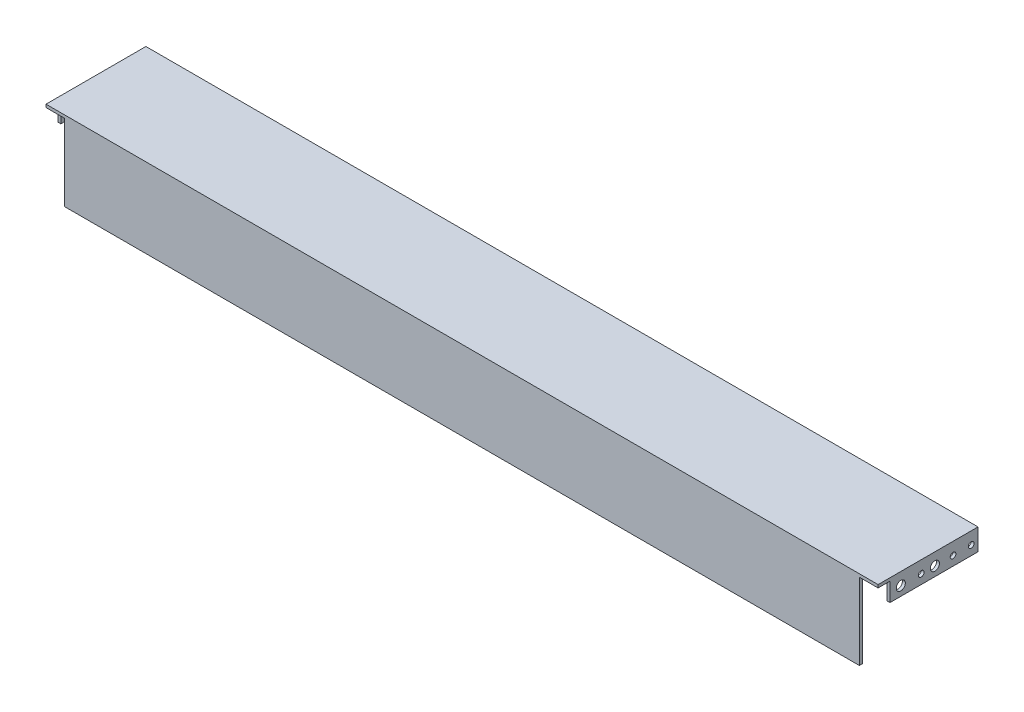
from build123d import *

# Parameters (mm, degrees)
SKETCH1_W           = 700
SKETCH1_H           = 70
BOSS_EXTRUDE1_DEPTH = 2.6
SKETCH2_W           = 733
SKETCH2_H           = 88
BOSS_EXTRUDE2_DEPTH = 2.6
SKETCH3_W           = 77.5
SKETCH3_H           = 16.4
SKETCH3_R           = 2.5
SKETCH3_R_2         = 4
BOSS_EXTRUDE3_DEPTH = 2.6
BOSS_EXTRUDE4_START = -2.6
SKETCH4_W           = 77.5
SKETCH4_H           = 16.4
SKETCH4_R           = 2.5
SKETCH4_R_2         = 4
BOSS_EXTRUDE4_DEPTH = 2.6


with BuildPart() as part:
    # Sketch1 → Boss-Extrude1 (new body)
    with BuildSketch(Plane.XY):
        Rectangle(SKETCH1_W, SKETCH1_H)
    extrude(amount=-BOSS_EXTRUDE1_DEPTH)

    # Sketch2 → Boss-Extrude2 (add)
    with BuildSketch(Plane(origin=(0, 35, 0), x_dir=(1, 0, 0), z_dir=(0, 1, 0))):
        with Locations((0, 44)):
            Rectangle(SKETCH2_W, SKETCH2_H)
    extrude(amount=-BOSS_EXTRUDE2_DEPTH)

    # Sketch3 → Boss-Extrude3 (add)
    with BuildSketch(Plane.ZY.offset(366.5)):
        with Locations((-49.25, 24.2)):
            Rectangle(SKETCH3_W, SKETCH3_H)
        with Locations(Location((-82, 24.2, 0), (0, 0, 270))):
            Circle(SKETCH3_R, mode=Mode.SUBTRACT)
        with Locations(Location((-66, 24.2, 0), (0, 0, 270))):
            Circle(SKETCH3_R, mode=Mode.SUBTRACT)
        with Locations(Location((-50, 24.2, 0), (0, 0, 270))):
            Circle(SKETCH3_R_2, mode=Mode.SUBTRACT)
        with Locations(Location((-38, 24.2, 0), (0, 0, 270))):
            Circle(SKETCH3_R, mode=Mode.SUBTRACT)
        with Locations(Location((-20, 24.2, 0), (0, 0, 270))):
            Circle(SKETCH3_R_2, mode=Mode.SUBTRACT)
    extrude(amount=-BOSS_EXTRUDE3_DEPTH)

    # Sketch4 → Boss-Extrude4 (add)
    with BuildSketch(Plane(origin=(366.5, 0, 0), x_dir=(0, 0, -1), z_dir=(1, 0, 0)).offset(BOSS_EXTRUDE4_START)):
        with Locations((49.25, 24.2)):
            Rectangle(SKETCH4_W, SKETCH4_H)
        with Locations(Location((38, 24.2, 0), (0, 0, 270))):
            Circle(SKETCH4_R, mode=Mode.SUBTRACT)
        with Locations(Location((50, 24.2, 0), (0, 0, 270))):
            Circle(SKETCH4_R_2, mode=Mode.SUBTRACT)
        with Locations(Location((66, 24.2, 0), (0, 0, 270))):
            Circle(SKETCH4_R, mode=Mode.SUBTRACT)
        with Locations(Location((82, 24.2, 0), (0, 0, 270))):
            Circle(SKETCH4_R, mode=Mode.SUBTRACT)
        with Locations(Location((20, 24.2, 0), (0, 0, 270))):
            Circle(SKETCH4_R_2, mode=Mode.SUBTRACT)
    extrude(amount=BOSS_EXTRUDE4_DEPTH)


solid = part.part
